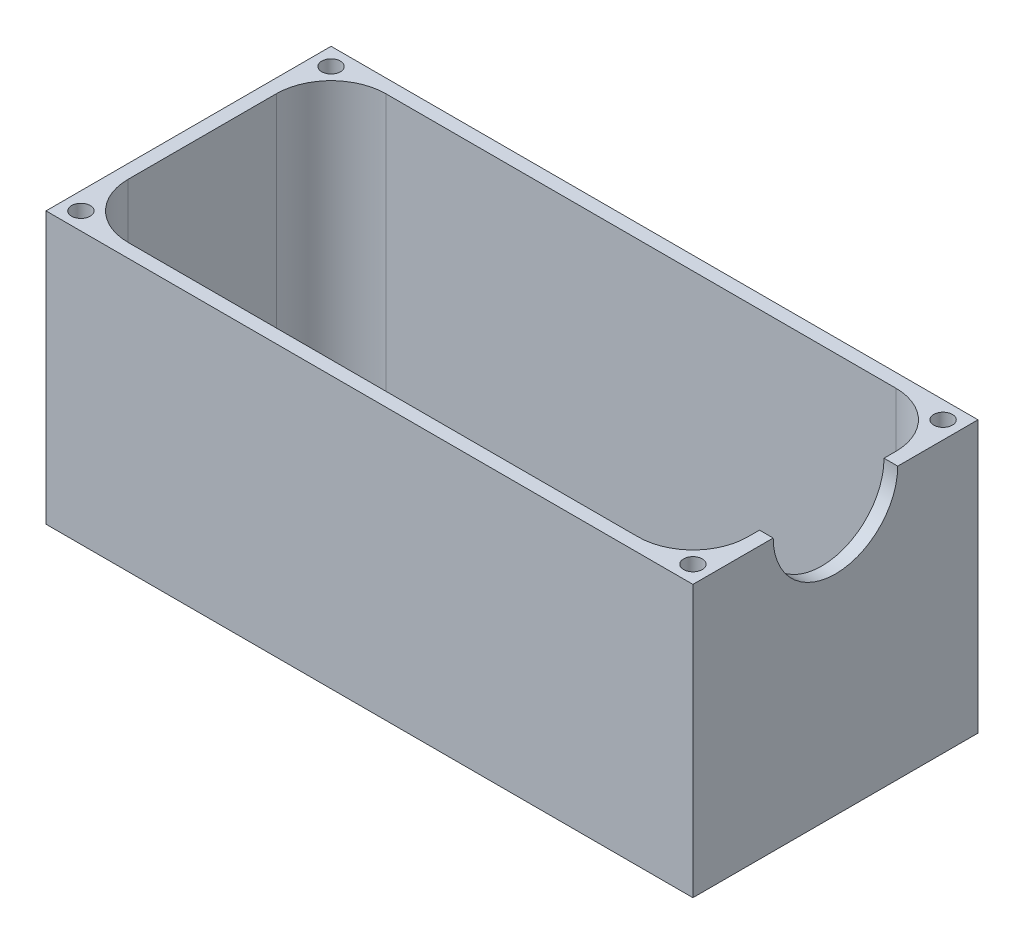
from build123d import *

# Parameters (mm, degrees)
SKETCH1_W           = 118
SKETCH1_H           = 52
BOSS_EXTRUDE1_DEPTH = 2.5
SKETCH2_W           = 118
SKETCH2_H           = 52
SKETCH2_W_2         = 113
SKETCH2_H_2         = 47
EXTRUDE_THIN1_DEPTH = 47
FILLET1_R           = 10
CUT_EXTRUDE1_DEPTH  = 42.5
SKETCH5_R           = 1.7
CUT_EXTRUDE2_DEPTH  = 6


with BuildPart() as part:
    # Sketch1 → Boss-Extrude1 (new body)
    with BuildSketch(Plane(origin=(0, 0, 0), x_dir=(1, 0, 0), z_dir=(0, 1, 0))):
        with Locations((6.893384754, 6.527166983)):
            Rectangle(SKETCH1_W, SKETCH1_H)
    extrude(amount=BOSS_EXTRUDE1_DEPTH)

    # Sketch2 → Extrude-Thin1 (add)
    with BuildSketch(Plane(origin=(0, 2.5, 0), x_dir=(1, 0, 0), z_dir=(0, 1, 0))):
        with Locations((6.893384754, 6.527166983)):
            Rectangle(SKETCH2_W, SKETCH2_H)
        with Locations((6.893384754, 6.527166983)):
            Rectangle(SKETCH2_W_2, SKETCH2_H_2, mode=Mode.SUBTRACT)
    extrude(amount=EXTRUDE_THIN1_DEPTH)

    # Fillet1
    fillet1_edges = [part.edges().sort_by_distance(p)[0] for p in [
        (-49.606615246, 26, 16.972833017),
        (63.393384754, 26, 16.972833017),
        (63.393384754, 26, -30.027166983),
        (-49.606615246, 26, -30.027166983),
    ]]
    fillet(fillet1_edges, radius=FILLET1_R)

    # Sketch3 → Cut-Extrude1 (cut)
    with BuildSketch(Plane(origin=(65.893384754, 0, 0), x_dir=(0, 0, -1), z_dir=(1, 0, 0))):
        with BuildLine():
            Line((-4.831942317, 49.5), (17.886276283, 49.5))
            ThreePointArc((17.886276283, 49.5), (6.527166983, 38.1408907), (-4.831942317, 49.5))
        make_face()
    extrude(amount=-CUT_EXTRUDE1_DEPTH, mode=Mode.SUBTRACT)

    # Sketch5 → Cut-Extrude2 (cut)
    with BuildSketch(Plane(origin=(0, 49.5, 0), x_dir=(1, 0, 0), z_dir=(0, 1, 0))):
        with Locations(Location((-48.924634731, -16.290852502, 0), (0, 0, 270))):
            Circle(SKETCH5_R)
        with Locations(Location((-48.924634731, 29.345186468, 0), (0, 0, 90))):
            Circle(SKETCH5_R)
        with Locations(Location((62.711404239, -16.290852502, 0), (0, 0, 90))):
            Circle(SKETCH5_R)
        with Locations(Location((62.711404239, 29.345186468, 0), (0, 0, 270))):
            Circle(SKETCH5_R)
    extrude(amount=-CUT_EXTRUDE2_DEPTH, mode=Mode.SUBTRACT)


solid = part.part
